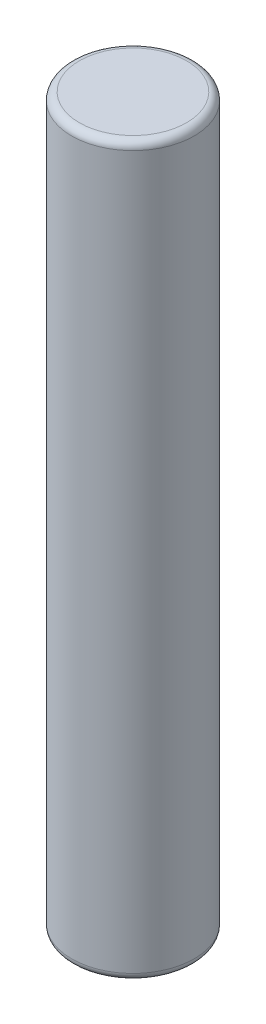
from build123d import *

# Parameters (mm, degrees)
SKETCH1_R           = 0.8
BOSS_EXTRUDE1_DEPTH = 9.5
FILLET1_R           = 0.1


with BuildPart() as part:
    # Sketch1 → Boss-Extrude1 (new body)
    with BuildSketch(Plane(origin=(0, 0, 0), x_dir=(1, 0, 0), z_dir=(0, 1, 0))):
        with Locations(Location((0, 0, 0), (0, 0, 270))):
            Circle(SKETCH1_R)
    extrude(amount=BOSS_EXTRUDE1_DEPTH)

    # Fillet1
    fillet1_edges = [part.edges().sort_by_distance(p)[0] for p in [
        (0, 0, -0.8),
        (0, 9.5, -0.8),
    ]]
    fillet(fillet1_edges, radius=FILLET1_R)


solid = part.part
